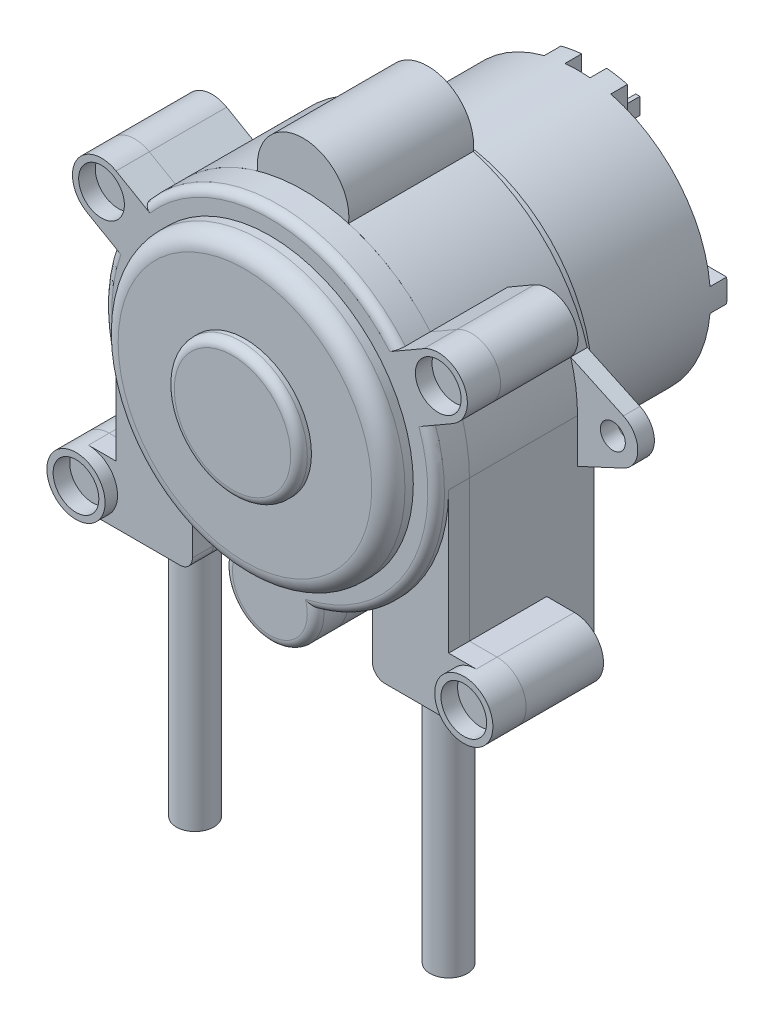
from build123d import *

# Parameters (mm, degrees)
RESSALTO_EXTRUS_O1_DEPTH    = 15
CORTE_EXTRUS_O1_DEPTH       = 5.7
ESBO_O3_R                   = 1.5
RESSALTO_EXTRUS_O2_DEPTH    = 2
ESBO_O4_R                   = 18
CORTE_EXTRUS_O2_DEPTH       = 10
ESBO_O5_R                   = 17.25
RESSALTO_EXTRUS_O3_DEPTH    = 2.5
ESBO_O6_R                   = 16
RESSALTO_EXTRUS_O4_DEPTH    = 17.5
ESBO_O7_R                   = 3.65
RESSALTO_EXTRUS_O5_DEPTH    = 3.5
ESBO_O8_W                   = 3
ESBO_O8_H                   = 6.3
CORTE_EXTRUS_O3_DEPTH       = 2
ESBO_O9_W                   = 0.5
ESBO_O9_H                   = 2
RESSALTO_EXTRUS_O6_DEPTH    = 3.5
RESSALTO_EXTRUS_O7_DEPTH    = 2.5
ESBO_O11_R                  = 3.5
RESSALTO_EXTRUS_O8_DEPTH    = 1.5
RESSALTO_EXTRUS_O9_START    = 3
ESBO_O12_R                  = 17.25
RESSALTO_EXTRUS_O9_DEPTH    = 3
ESBO_O13_R                  = 8
RESSALTO_EXTRUS_O10_DEPTH   = 1.5
ESBO_O14_R                  = 2.75
CORTE_EXTRUS_O4_DEPTH       = 2
ESBO_O15_R                  = 2.25
RESSALTO_EXTRUS_O11_DEPTH   = 30
RESSALTO_EXTRUS_O11_2_DEPTH = 30
FILETE1_R                   = 2
FILETE2_R                   = 1
ESBO_O16_R                  = 6.75
RESSALTO_EXTRUS_O12_DEPTH   = 10
RESSALTO_EXTRUS_O12_2_DEPTH = 10
RESSALTO_EXTRUS_O12_3_DEPTH = 10
RESSALTO_EXTRUS_O13_DEPTH   = 1


with BuildPart() as part:
    # Esboço1 → Ressalto-extrusão1 (new body)
    with BuildSketch(Plane.XY):
        with BuildLine():
            Line((-20, 0), (-20, -17))
            Line((-20, -17), (-23.325, -17))
            ThreePointArc((-23.325, -17), (-26.825, -20.5), (-23.325, -24))
            Line((-23.325, -24), (-12.325, -24))
            ThreePointArc((-12.325, -24), (-11.264339828, -23.560660172), (-10.825, -22.5))
            Line((-10.825, -22.5), (-10.825, -16.817234463))
            ThreePointArc((-10.825, -16.817234463), (-8.232270863, -18.227169732), (-5.460280697, -19.240201005))
            ThreePointArc((-5.460280697, -19.240201005), (0, -25.4), (5.460280697, -19.240201005))
            ThreePointArc((5.460280697, -19.240201005), (8.232270863, -18.227169732), (10.825, -16.817234463))
            Line((10.825, -16.817234463), (10.825, -22.5))
            ThreePointArc((10.825, -22.5), (11.264339828, -23.560660172), (12.325, -24))
            Line((12.325, -24), (23.325, -24))
            ThreePointArc((23.325, -24), (26.825, -20.5), (23.325, -17))
            Line((23.325, -17), (20, -17))
            Line((20, -17), (20, 0))
            ThreePointArc((20, 0), (19.698534337, 3.459442872), (18.803225501, 6.814595421))
            Line((18.803225501, 6.814595421), (22, 8.660254038))
            ThreePointArc((22, 8.660254038), (23.281088913, 13.441342951), (18.5, 14.722431864))
            Line((18.5, 14.722431864), (15.303225501, 12.876773247))
            ThreePointArc((15.303225501, 12.876773247), (10.858365467, 16.795710744), (5.460280697, 19.240201005))
            ThreePointArc((5.460280697, 19.240201005), (0, 25.4), (-5.460280697, 19.240201005))
            ThreePointArc((-5.460280697, 19.240201005), (-10.858365467, 16.795710744), (-15.303225501, 12.876773247))
            Line((-15.303225501, 12.876773247), (-18.5, 14.722431864))
            ThreePointArc((-18.5, 14.722431864), (-23.281088913, 13.441342951), (-22, 8.660254038))
            Line((-22, 8.660254038), (-18.803225501, 6.814595421))
            ThreePointArc((-18.803225501, 6.814595421), (-19.698534337, 3.459442872), (-20, 0))
        make_face()
    extrude(amount=RESSALTO_EXTRUS_O1_DEPTH)

    # Esboço2 → Corte-extrusão1 (cut)
    with BuildSketch(Plane(origin=(0, 0, 0), x_dir=(-1, 0, 0), z_dir=(0, 0, -1))):
        with BuildLine():
            Line((-20, -17), (-20, -24))
            Line((-20, -24), (-23.325, -24))
            ThreePointArc((-23.325, -24), (-26.825, -20.5), (-23.325, -17))
            Line((-23.325, -17), (-20, -17))
        make_face()
        with BuildLine():
            Line((20, -17), (20, -24))
            Line((20, -24), (23.325, -24))
            ThreePointArc((23.325, -24), (26.825, -20.5), (23.325, -17))
            Line((23.325, -17), (20, -17))
        make_face()
        with BuildLine():
            Line((18.803225501, 6.814595421), (22, 8.660254038))
            ThreePointArc((22, 8.660254038), (23.281088913, 13.441342951), (18.5, 14.722431864))
            Line((18.5, 14.722431864), (15.303225501, 12.876773247))
            ThreePointArc((15.303225501, 12.876773247), (17.320508076, 10), (18.803225501, 6.814595421))
        make_face()
        with BuildLine():
            Line((-15.303225501, 12.876773247), (-18.5, 14.722431864))
            ThreePointArc((-18.5, 14.722431864), (-23.281088913, 13.441342951), (-22, 8.660254038))
            Line((-22, 8.660254038), (-18.803225501, 6.814595421))
            ThreePointArc((-18.803225501, 6.814595421), (-17.320508076, 10), (-15.303225501, 12.876773247))
        make_face()
    extrude(amount=-CORTE_EXTRUS_O1_DEPTH, mode=Mode.SUBTRACT)

    # Esboço3 → Ressalto-extrusão2 (add)
    with BuildSketch(Plane(origin=(0, 0, 0), x_dir=(-1, 0, 0), z_dir=(0, 0, -1))):
        with BuildLine():
            Line((-25.517854785, 2.718923361), (0, 14.618094467))
            Line((0, 14.618094467), (25.517854785, 2.718923361))
            ThreePointArc((25.517854785, 2.718923361), (27.25, 0), (25.517854785, -2.718923361))
            Line((25.517854785, -2.718923361), (0, -14.618094467))
            Line((0, -14.618094467), (-25.517854785, -2.718923361))
            ThreePointArc((-25.517854785, -2.718923361), (-27.25, 0), (-25.517854785, 2.718923361))
        make_face()
        with Locations((-24.25, 0)):
            Circle(ESBO_O3_R, mode=Mode.SUBTRACT)
        with Locations((24.25, 0)):
            Circle(ESBO_O3_R, mode=Mode.SUBTRACT)
    extrude(amount=-RESSALTO_EXTRUS_O2_DEPTH)

    # Esboço4 → Corte-extrusão2 (cut)
    with BuildSketch(Plane.XY.offset(15)):
        Circle(ESBO_O4_R)
    extrude(amount=-CORTE_EXTRUS_O2_DEPTH, mode=Mode.SUBTRACT)

    # Esboço5 → Ressalto-extrusão3 (add)
    with BuildSketch(Plane(origin=(0, 0, 0), x_dir=(-1, 0, 0), z_dir=(0, 0, -1))):
        Circle(ESBO_O5_R)
    extrude(amount=RESSALTO_EXTRUS_O3_DEPTH)


with BuildPart() as body_2:
    # Esboço6 → Ressalto-extrusão4 (new body)
    with BuildSketch(Plane(origin=(0, 0, -2.5), x_dir=(-1, 0, 0), z_dir=(0, 0, -1))):
        Circle(ESBO_O6_R)
    extrude(amount=RESSALTO_EXTRUS_O4_DEPTH)

    # Esboço7 → Ressalto-extrusão5 (add)
    with BuildSketch(Plane(origin=(0, 0, -20), x_dir=(-1, 0, 0), z_dir=(0, 0, -1))):
        Circle(ESBO_O7_R)
    extrude(amount=RESSALTO_EXTRUS_O5_DEPTH)

    # Esboço8 → Corte-extrusão3 (cut)
    with BuildSketch(Plane(origin=(0, 0, -20), x_dir=(-1, 0, 0), z_dir=(0, 0, -1))):
        with BuildLine():
            Line((-4, 15.491933385), (-4, 3.4))
            ThreePointArc((-4, 3.4), (-4.585786438, 1.985786438), (-6, 1.4))
            Line((-6, 1.4), (-15.938632313, 1.4))
            ThreePointArc((-15.938632313, 1.4), (-12.207903639, 10.342489485), (-4, 15.491933385))
        make_face()
        with BuildLine():
            Line((4, 15.491933385), (4, 3.4))
            ThreePointArc((4, 3.4), (4.585786438, 1.985786438), (6, 1.4))
            Line((6, 1.4), (15.938632313, 1.4))
            ThreePointArc((15.938632313, 1.4), (12.207903639, 10.342489485), (4, 15.491933385))
        make_face()
        with BuildLine():
            Line((-15.938632313, -1.4), (-6, -1.4))
            ThreePointArc((-6, -1.4), (-4.585786438, -1.985786438), (-4, -3.4))
            Line((-4, -3.4), (-4, -15.491933385))
            ThreePointArc((-4, -15.491933385), (-12.207903639, -10.342489485), (-15.938632313, -1.4))
        make_face()
        with BuildLine():
            Line((4, -3.4), (4, -15.491933385))
            ThreePointArc((4, -15.491933385), (12.207903639, -10.342489485), (15.938632313, -1.4))
            Line((15.938632313, -1.4), (6, -1.4))
            ThreePointArc((6, -1.4), (4.585786438, -1.985786438), (4, -3.4))
        make_face()
        with Locations((0, 16)):
            Rectangle(ESBO_O8_W, ESBO_O8_H)
        with Locations((0, -16)):
            Rectangle(ESBO_O8_W, ESBO_O8_H)
    extrude(amount=-CORTE_EXTRUS_O3_DEPTH, mode=Mode.SUBTRACT)

    # Esboço9 → Ressalto-extrusão6 (add)
    with BuildSketch(Plane(origin=(0, 0, -20), x_dir=(-1, 0, 0), z_dir=(0, 0, -1))):
        with Locations((-1.75, 10.5)):
            Rectangle(ESBO_O9_W, ESBO_O9_H)
        with Locations((1.75, -10.5)):
            Rectangle(ESBO_O9_W, ESBO_O9_H)
    extrude(amount=RESSALTO_EXTRUS_O6_DEPTH)


with BuildPart() as body_3:
    # Esboço10 → Ressalto-extrusão7 (new body)
    with BuildSketch(Plane.XY.offset(15)):
        with BuildLine():
            Line((18.803225501, 6.814595421), (22, 8.660254038))
            ThreePointArc((22, 8.660254038), (23.281088913, 13.441342951), (18.5, 14.722431864))
            Line((18.5, 14.722431864), (15.303225501, 12.876773247))
            ThreePointArc((15.303225501, 12.876773247), (0, 20), (-15.303225501, 12.876773247))
            Line((-15.303225501, 12.876773247), (-18.5, 14.722431864))
            ThreePointArc((-18.5, 14.722431864), (-23.281088913, 13.441342951), (-22, 8.660254038))
            Line((-22, 8.660254038), (-18.803225501, 6.814595421))
            ThreePointArc((-18.803225501, 6.814595421), (-19.698534337, 3.459442872), (-20, 0))
            Line((-20, 0), (-20, -17))
            Line((-20, -17), (-23.325, -17))
            ThreePointArc((-23.325, -17), (-26.825, -20.5), (-23.325, -24))
            Line((-23.325, -24), (-12.325, -24))
            ThreePointArc((-12.325, -24), (-11.264339828, -23.560660172), (-10.825, -22.5))
            Line((-10.825, -22.5), (-10.825, -16.817234463))
            ThreePointArc((-10.825, -16.817234463), (-8.232270863, -18.227169732), (-5.460280697, -19.240201005))
            ThreePointArc((-5.460280697, -19.240201005), (0, -25.4), (5.460280697, -19.240201005))
            ThreePointArc((5.460280697, -19.240201005), (8.232270863, -18.227169732), (10.825, -16.817234463))
            Line((10.825, -16.817234463), (10.825, -22.5))
            ThreePointArc((10.825, -22.5), (11.264339828, -23.560660172), (12.325, -24))
            Line((12.325, -24), (23.325, -24))
            ThreePointArc((23.325, -24), (26.825, -20.5), (23.325, -17))
            Line((23.325, -17), (20, -17))
            Line((20, -17), (20, 0))
            ThreePointArc((20, 0), (19.698534337, 3.459442872), (18.803225501, 6.814595421))
        make_face()
    extrude(amount=RESSALTO_EXTRUS_O7_DEPTH)

    # Esboço11 → Ressalto-extrusão8 (add)
    with BuildSketch(Plane.XY.offset(17.5)):
        with Locations(Location((-23.325, -20.5, 0), (0, 0, 270))):
            Circle(ESBO_O11_R)
        with Locations(Location((23.325, -20.5, 0), (0, 0, 90))):
            Circle(ESBO_O11_R)
        with BuildLine():
            Line((18.5, 14.722431864), (15.303225501, 12.876773247))
            ThreePointArc((15.303225501, 12.876773247), (0, 20), (-15.303225501, 12.876773247))
            Line((-15.303225501, 12.876773247), (-18.5, 14.722431864))
            ThreePointArc((-18.5, 14.722431864), (-23.281088913, 13.441342951), (-22, 8.660254038))
            Line((-22, 8.660254038), (-18.803225501, 6.814595421))
            ThreePointArc((-18.803225501, 6.814595421), (-17.80147571, -9.116329445), (-5.460280697, -19.240201005))
            ThreePointArc((-5.460280697, -19.240201005), (0, -25.4), (5.460280697, -19.240201005))
            ThreePointArc((5.460280697, -19.240201005), (17.80147571, -9.116329445), (18.803225501, 6.814595421))
            Line((18.803225501, 6.814595421), (22, 8.660254038))
            ThreePointArc((22, 8.660254038), (23.281088913, 13.441342951), (18.5, 14.722431864))
        make_face()
    extrude(amount=RESSALTO_EXTRUS_O8_DEPTH)

    # Esboço12 → Ressalto-extrusão9 (add)
    with BuildSketch(Plane.XY.offset(19).offset(RESSALTO_EXTRUS_O9_START)):
        Circle(ESBO_O12_R)
    extrude(amount=-RESSALTO_EXTRUS_O9_DEPTH)

    # Esboço13 → Ressalto-extrusão10 (add)
    with BuildSketch(Plane.XY.offset(22)):
        Circle(ESBO_O13_R)
    extrude(amount=RESSALTO_EXTRUS_O10_DEPTH)

    # Esboço14 → Corte-extrusão4 (cut)
    with BuildSketch(Plane.XY.offset(19)):
        with Locations((-23.325, -20.5)):
            Circle(ESBO_O14_R)
        with Locations((23.325, -20.5)):
            Circle(ESBO_O14_R)
        with Locations((20.25, 11.691342951)):
            Circle(ESBO_O14_R)
        with Locations((-20.25, 11.691342951)):
            Circle(ESBO_O14_R)
    extrude(amount=-CORTE_EXTRUS_O4_DEPTH, mode=Mode.SUBTRACT)

    # Filete1
    filete1_edges = [body_3.edges().sort_by_distance(p)[0] for p in [
        (-17.25, 0, 22),
    ]]
    fillet(filete1_edges, radius=FILETE1_R)

    # Filete2
    filete2_edges = [body_3.edges().sort_by_distance(p)[0] for p in [
        (-8, 0, 23.5),
        (0, 20, 19),
        (-17.80147571, -9.116329445, 19),
        (0, -25.4, 19),
        (17.80147571, -9.116329445, 19),
    ]]
    fillet(filete2_edges, radius=FILETE2_R)


with BuildPart() as body_4:
    # Esboço15 → Ressalto-extrusão11 (new body)
    with BuildSketch(Plane.XZ.offset(24)):
        with Locations((-15.25, 12.75)):
            Circle(ESBO_O15_R)
    extrude(amount=RESSALTO_EXTRUS_O11_DEPTH)


with BuildPart() as body_5:
    # Esboço15 → Ressalto-extrus_o11 2 (new body)
    with BuildSketch(Plane.XZ.offset(24)):
        with Locations((15.25, 12.75)):
            Circle(ESBO_O15_R)
    extrude(amount=RESSALTO_EXTRUS_O11_2_DEPTH)


with BuildPart() as body_6:
    # Esboço16 → Ressalto-extrusão12 (new body)
    with BuildSketch(Plane.XY.offset(5)):
        with Locations((0, 10.5)):
            Circle(ESBO_O16_R)
    extrude(amount=RESSALTO_EXTRUS_O12_DEPTH)


with BuildPart() as body_7:
    # Esboço16 → Ressalto-extrus_o12 2 (new body)
    with BuildSketch(Plane.XY.offset(5)):
        with Locations((9.09326674, -5.25)):
            Circle(ESBO_O16_R)
    extrude(amount=RESSALTO_EXTRUS_O12_2_DEPTH)


with BuildPart() as body_8:
    # Esboço16 → Ressalto-extrus_o12 3 (new body)
    with BuildSketch(Plane.XY.offset(5)):
        with Locations((-9.09326674, -5.25)):
            Circle(ESBO_O16_R)
    extrude(amount=RESSALTO_EXTRUS_O12_3_DEPTH)


with BuildPart() as body_9:
    # Esboço17 → Ressalto-extrusão13 (new body)
    with BuildSketch(Plane.XY.offset(15)):
        with BuildLine():
            Line((5, 10.5), (5, 5.773502692))
            ThreePointArc((5, 5.773502692), (5.669872981, 3.273502692), (7.5, 1.443375673))
            Line((7.5, 1.443375673), (11.59326674, -0.919872981))
            ThreePointArc((11.59326674, -0.919872981), (13.423393759, -7.75), (6.59326674, -9.580127019))
            Line((6.59326674, -9.580127019), (2.5, -7.216878365))
            ThreePointArc((2.5, -7.216878365), (0, -6.547005384), (-2.5, -7.216878365))
            Line((-2.5, -7.216878365), (-6.59326674, -9.580127019))
            ThreePointArc((-6.59326674, -9.580127019), (-13.423393759, -7.75), (-11.59326674, -0.919872981))
            Line((-11.59326674, -0.919872981), (-7.5, 1.443375673))
            ThreePointArc((-7.5, 1.443375673), (-5.669872981, 3.273502692), (-5, 5.773502692))
            Line((-5, 5.773502692), (-5, 10.5))
            ThreePointArc((-5, 10.5), (0, 15.5), (5, 10.5))
        make_face()
    extrude(amount=RESSALTO_EXTRUS_O13_DEPTH)


solid = Compound([part.part, body_2.part, body_3.part, body_4.part, body_5.part, body_6.part, body_7.part, body_8.part, body_9.part])
